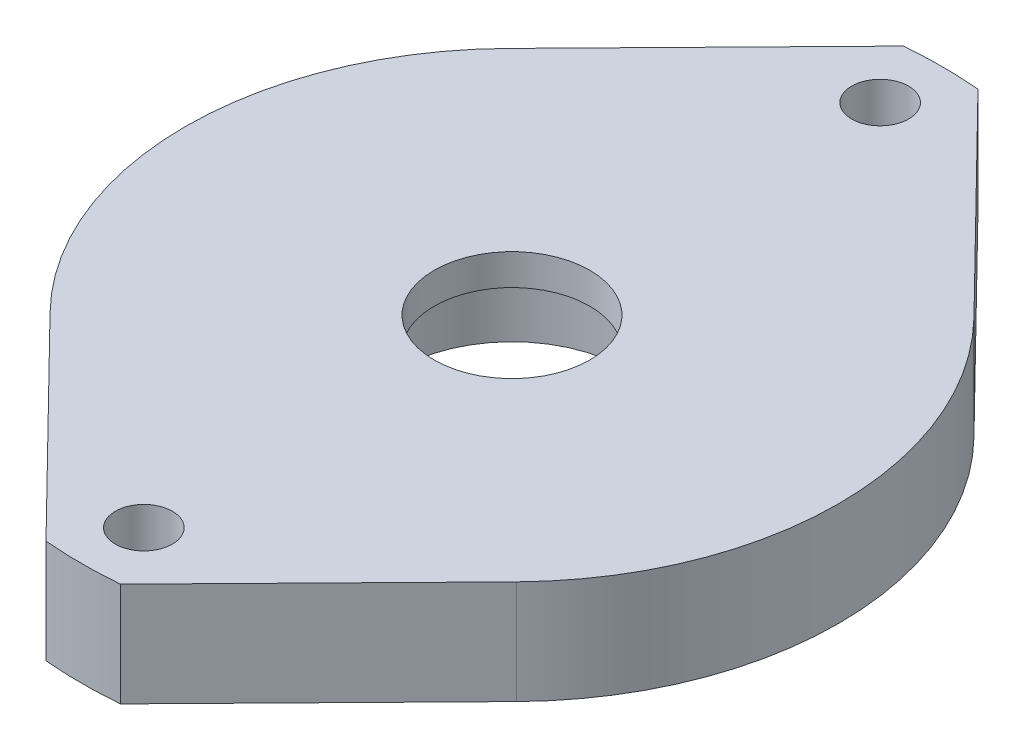
from build123d import *

# Parameters (mm, degrees)
SKETCH1_R            = 41.5
BOSS_EXTRUDE1_DEPTH  = 10
SKETCH2_OUTSIDE_W    = 108.56
SKETCH2_OUTSIDE_H    = 108.56
CUT_EXTRUDE1_DEPTH   = 10
SKETCH3_R            = 11
CUT_EXTRUDE2_DEPTH   = 7
CUT_EXTRUDE3_REACH   = 54.569
SKETCH4_R            = 7.5
M5_CLEARANCE_HOLE1_D = 5.5


with BuildPart() as part:
    # Sketch1 → Boss-Extrude1 (new body)
    with BuildSketch(Plane(origin=(0, 0, 0), x_dir=(1, 0, 0), z_dir=(0, 1, 0))):
        with Locations(Location((0, 0, 0), (0, 0, 270))):
            Circle(SKETCH1_R)
    extrude(amount=BOSS_EXTRUDE1_DEPTH)

    # Sketch2 outside → Cut-Extrude1 (cut)
    with BuildSketch(Plane.XZ):
        Rectangle(SKETCH2_OUTSIDE_W, SKETCH2_OUTSIDE_H)
        with BuildLine():
            Line((-22.5, 22.045407685), (-3.590980448, 41.344344951))
            ThreePointArc((-3.590980448, 41.344344951), (0, 41.5), (3.590980448, 41.344344951))
            Line((3.590980448, 41.344344951), (22.5, 22.045407685))
            ThreePointArc((22.5, 22.045407685), (31.5, 0), (22.5, -22.045407685))
            Line((22.5, -22.045407685), (3.590980448, -41.344344951))
            ThreePointArc((3.590980448, -41.344344951), (0, -41.5), (-3.590980448, -41.344344951))
            Line((-3.590980448, -41.344344951), (-22.5, -22.045407685))
            ThreePointArc((-22.5, -22.045407685), (-31.5, 0), (-22.5, 22.045407685))
        make_face(mode=Mode.SUBTRACT)
    extrude(amount=-CUT_EXTRUDE1_DEPTH, mode=Mode.SUBTRACT)

    # Sketch3 → Cut-Extrude2 (cut)
    with BuildSketch(Plane(origin=(0, 0, 0), x_dir=(1, 0, 0), z_dir=(0, 1, 0))):
        with Locations(Location((0, 0, 0), (0, 0, 270))):
            Circle(SKETCH3_R)
    extrude(amount=CUT_EXTRUDE2_DEPTH, mode=Mode.SUBTRACT)

    # Sketch4 → Cut-Extrude3 (cut, up to next)
    with BuildSketch(Plane.XZ.offset(-7), mode=Mode.PRIVATE) as cut_extrude3_sk1:
        with Locations(Location((0, 0, 0), (0, 0, 270))):
            Circle(SKETCH4_R)
    cut_extrude3_tool1 = extrude(cut_extrude3_sk1.sketch, amount=-CUT_EXTRUDE3_REACH, mode=Mode.PRIVATE) & part.part
    add(cut_extrude3_tool1.solids().sort_by_distance((0, 7, 0))[0], mode=Mode.SUBTRACT)

    # M5 Clearance Hole1 (through all)
    with Locations(Plane(origin=(0, 0, 0), x_dir=(-1, 0, 0), z_dir=(0, -1, 0))):
        with Locations((0, 35.5), (0, -35.5)):
            Hole(M5_CLEARANCE_HOLE1_D / 2)


solid = part.part
